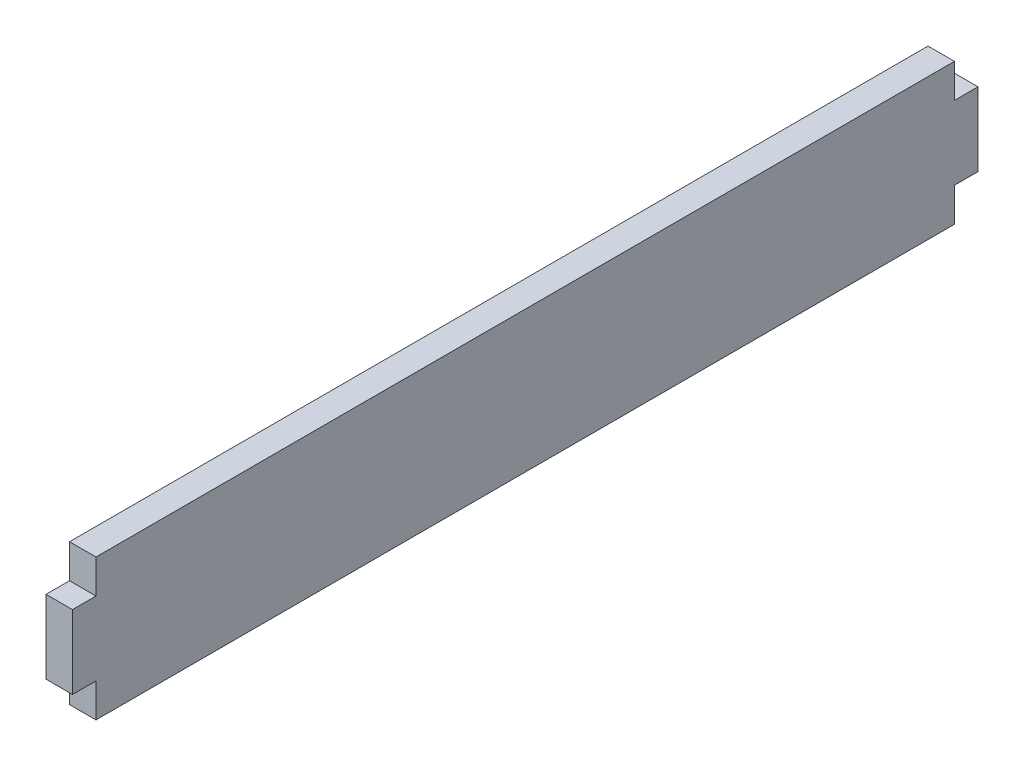
from build123d import *

# Parameters (mm, degrees)
BOSS_EXTRUDE1_DEPTH = 18


with BuildPart() as part:
    # Sketch1 → Boss-Extrude1 (new body)
    with BuildSketch(Plane(origin=(0, 0, 0), x_dir=(0, 0, -1), z_dir=(1, 0, 0))):
        Polygon((-20.354138571, 148.246124223), (563.645861429, 148.246124223), (563.645861429, 125.246124223), (579.645861429, 125.246124223), (579.645861429, 75.246124223), (563.645861429, 75.246124223), (563.645861429, 52.246124223), (-20.354138571, 52.246124223), (-20.354138571, 75.246124223), (-36.354138571, 75.246124223), (-36.354138571, 125.246124223), (-20.354138571, 125.246124223), align=None)
    extrude(amount=BOSS_EXTRUDE1_DEPTH)


solid = part.part
